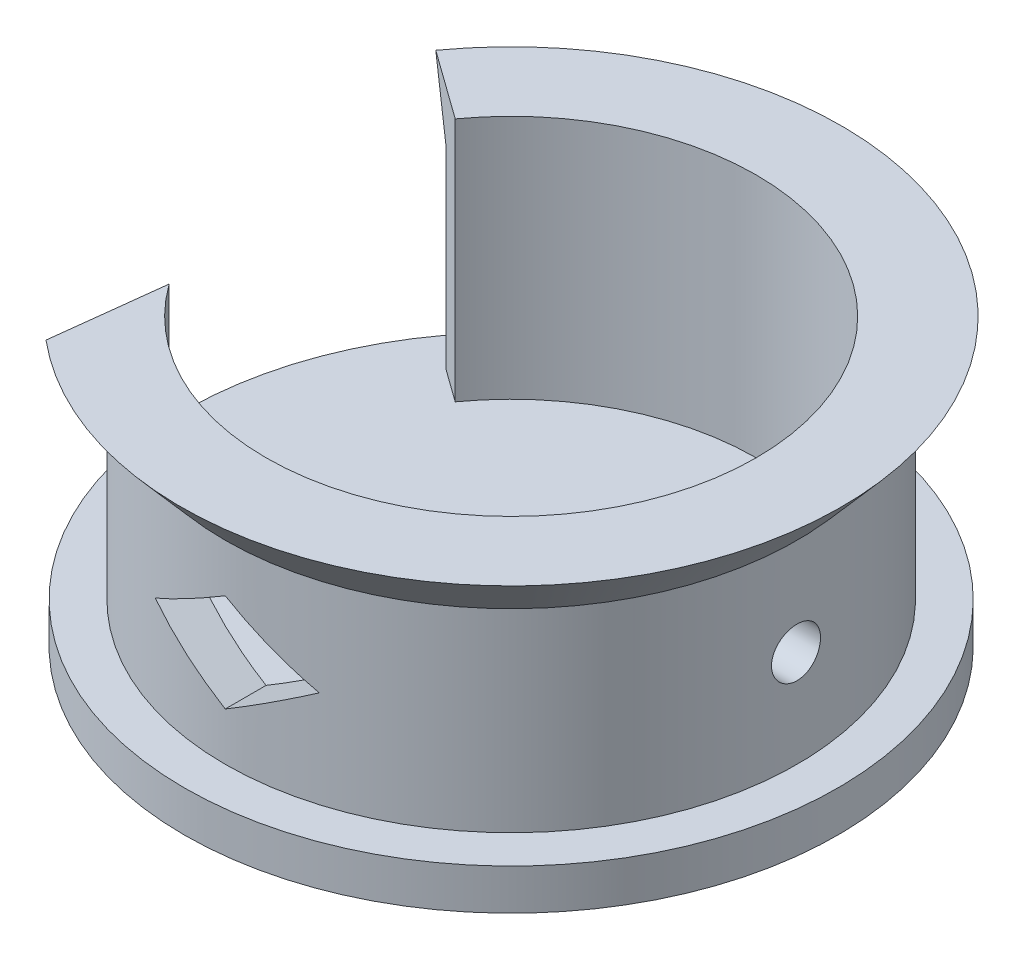
from build123d import *

# Parameters (mm, degrees)
SKETCH4_R           = 8
BOSS_EXTRUDE3_DEPTH = 1
SKETCH5_R           = 7
SKETCH5_R_2         = 6
BOSS_EXTRUDE4_DEPTH = 4.75
CUT_EXTRUDE3_START  = -3
SKETCH9_R           = 6
CUT_EXTRUDE3_DEPTH  = 3
CUT_EXTRUDE7_DEPTH  = 10
SKETCH13_R          = 2.4
CUT_EXTRUDE8_DEPTH  = 10
CUT_EXTRUDE9_START  = -6
CUT_EXTRUDE9_DEPTH  = 6
CUT_EXTRUDE10_DEPTH = 10


with BuildPart() as part:
    # Sketch4 → Boss-Extrude3 (new body)
    with BuildSketch(Plane(origin=(0, 0, 0), x_dir=(1, 0, 0), z_dir=(0, 1, 0))):
        with Locations(Location((0, 0, 0), (0, 0, 270))):
            Circle(SKETCH4_R)
    extrude(amount=BOSS_EXTRUDE3_DEPTH)

    # Sketch5 → Boss-Extrude4 (add)
    with BuildSketch(Plane(origin=(0, 1, 0), x_dir=(1, 0, 0), z_dir=(0, 1, 0))):
        with Locations(Location((0, 0, 0), (0, 0, 270))):
            Circle(SKETCH5_R)
        with Locations(Location((0, 0, 0), (0, 0, 270))):
            Circle(SKETCH5_R_2, mode=Mode.SUBTRACT)
    extrude(amount=BOSS_EXTRUDE4_DEPTH)

    # Sketch6 → Revolve4 (revolve)
    with BuildSketch(Plane.XY, mode=Mode.PRIVATE) as revolve4_sk:
        Polygon((0, 5.75), (7, 5.75), (6, 7), (0, 7), align=None)
    revolve(revolve4_sk.sketch.rotate(Axis((0, 5.75, 0), (0, 1, 0)), 90), axis=Axis((0, 5.75, 0), (0, 1, 0)))

    # Sketch9 → Cut-Extrude3 (cut)
    with BuildSketch(Plane(origin=(0, 7, 0), x_dir=(1, 0, 0), z_dir=(0, 1, 0)).offset(CUT_EXTRUDE3_START)):
        with Locations(Location((0, 0, 0), (0, 0, 270))):
            Circle(SKETCH9_R)
    extrude(amount=CUT_EXTRUDE3_DEPTH, mode=Mode.SUBTRACT)

    # Sketch11 → Cut-Extrude7 (cut)
    with BuildSketch(Plane.XY):
        Polygon((0, 2.175), (2.007816798, 3.373213723), (0, 4.575), (-2.009525275, 3.375), align=None)
    extrude(amount=CUT_EXTRUDE7_DEPTH, mode=Mode.SUBTRACT)

    # Sketch13 → Cut-Extrude8 (cut)
    with BuildSketch(Plane(origin=(0, 1, 0), x_dir=(1, 0, 0), z_dir=(0, 1, 0))):
        with Locations(Location((0, 0, 0), (0, 0, 270))):
            Circle(SKETCH13_R)
    extrude(amount=-CUT_EXTRUDE8_DEPTH, mode=Mode.SUBTRACT)

    # Sketch14 → Revolve5 (revolve)
    with BuildSketch(Plane.XY):
        Polygon((6, 7), (6, 5.75), (7, 5.75), (8.08473241, 7), align=None)
    revolve(axis=Axis((0, 5.75, 0), (0, 1, 0)))

    # Sketch15 → Cut-Extrude9 (cut)
    with BuildSketch(Plane(origin=(0, 7, 0), x_dir=(1, 0, 0), z_dir=(0, 1, 0)).offset(CUT_EXTRUDE9_START)):
        with BuildLine():
            Line((-5.191534566, -6.197650119), (-4.871861689, -3.502137017))
            ThreePointArc((-4.871861689, -3.502137017), (-6, 0), (-4.871861689, 3.502137017))
            Line((-4.871861689, 3.502137017), (-6.564616348, 4.718973441))
            ThreePointArc((-6.564616348, 4.718973441), (-8.02152969, -1.008939827), (-5.191534566, -6.197650119))
        make_face()
    extrude(amount=CUT_EXTRUDE9_DEPTH, mode=Mode.SUBTRACT)

    # Sketch16 → Cut-Extrude10 (cut)
    with BuildSketch(Plane(origin=(0, 0, 0), x_dir=(0, 0, -1), z_dir=(1, 0, 0))):
        with BuildLine():
            ThreePointArc((0.6, 3.375), (0.424264069, 3.799264069), (0, 3.975))
            Line((0, 3.975), (0, 2.775))
            ThreePointArc((0, 2.775), (0.424264069, 2.950735931), (0.6, 3.375))
        make_face()
        with BuildLine():
            Line((0, 2.775), (0, 3.975))
            ThreePointArc((0, 3.975), (-0.6, 3.375), (0, 2.775))
        make_face()
    extrude(amount=CUT_EXTRUDE10_DEPTH, mode=Mode.SUBTRACT)


solid = part.part
